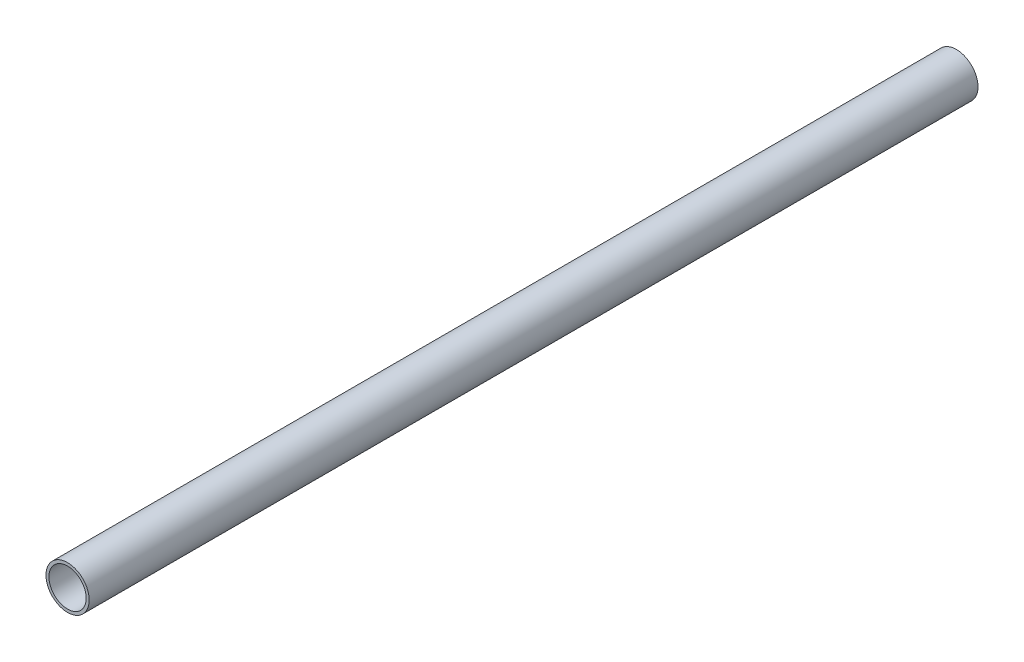
from build123d import *

# Parameters (mm, degrees)
SKETCH3_R           = 22.225
SKETCH3_R_2         = 19.177
BOSS_EXTRUDE1_DEPTH = 457.2


with BuildPart() as part:
    # Sketch3 → Boss-Extrude1 (new, symmetric)
    with BuildSketch(Plane.XY):
        Circle(SKETCH3_R)
        Circle(SKETCH3_R_2, mode=Mode.SUBTRACT)
    extrude(amount=BOSS_EXTRUDE1_DEPTH, both=True)


solid = part.part
